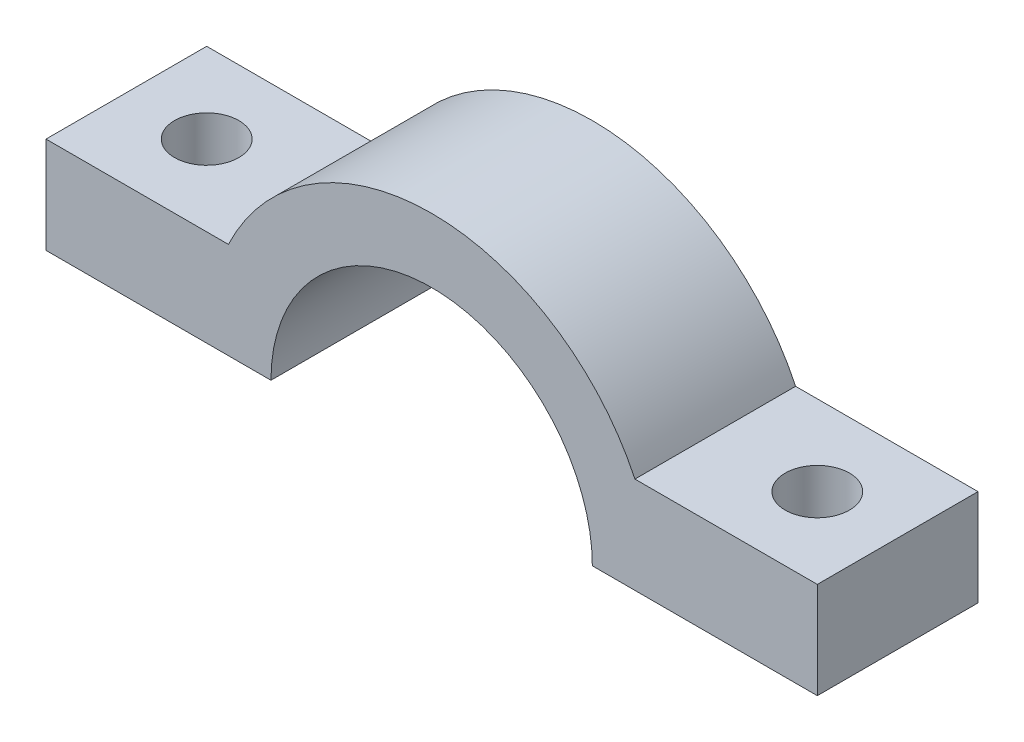
from build123d import *

# Parameters (mm, degrees)
BOSS_EXTRUDE1_DEPTH = 5
SKETCH2_R           = 1
CUT_EXTRUDE1_DEPTH  = 5


with BuildPart() as part:
    # Sketch1 → Boss-Extrude1 (new body)
    with BuildSketch(Plane.XY):
        with BuildLine():
            Line((-7, 0), (-5, 0))
            ThreePointArc((-5, 0), (0, 5), (5, 0))
            Line((5, 0), (7, 0))
            Line((7, 0), (12, 0))
            Line((12, 0), (12, 3))
            Line((12, 3), (6.32455532, 3))
            ThreePointArc((6.32455532, 3), (0, 7), (-6.32455532, 3))
            Line((-6.32455532, 3), (-12, 3))
            Line((-12, 3), (-12, 0))
            Line((-12, 0), (-7, 0))
        make_face()
    extrude(amount=BOSS_EXTRUDE1_DEPTH)

    # Sketch2 → Cut-Extrude1 (cut)
    with BuildSketch(Plane(origin=(0, 3, 0), x_dir=(1, 0, 0), z_dir=(0, 1, 0))):
        with Locations(Location((-9.5, -2.5, 0), (0, 0, 270))):
            Circle(SKETCH2_R)
        with Locations(Location((9.5, -2.5, 0), (0, 0, 180))):
            Circle(SKETCH2_R)
    extrude(amount=-CUT_EXTRUDE1_DEPTH, mode=Mode.SUBTRACT)


solid = part.part
